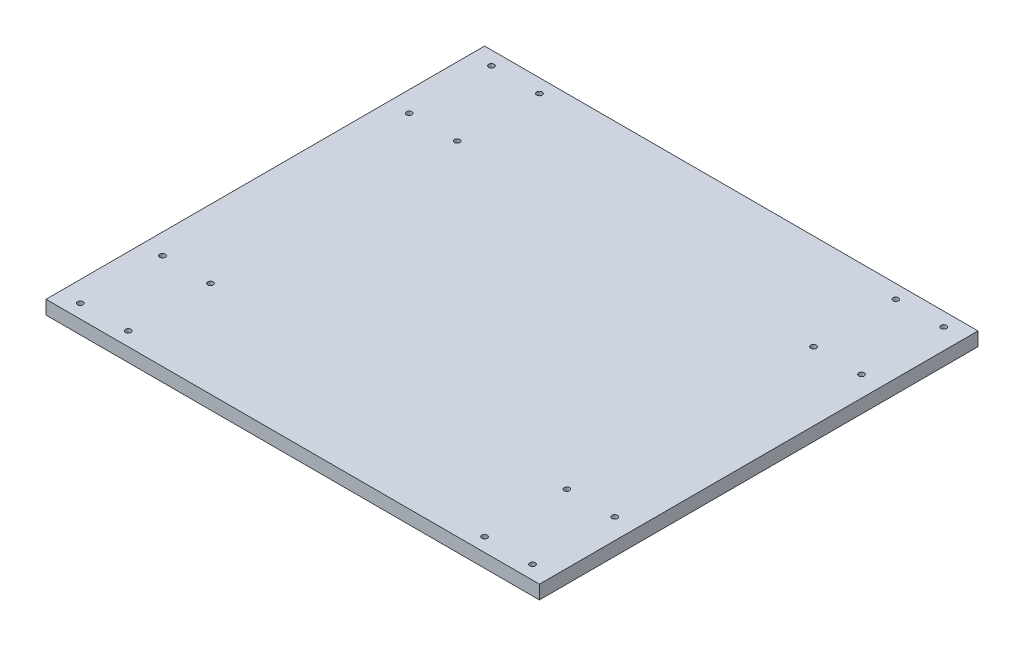
from build123d import *

# Parameters (mm, degrees)
SKETCH1_W                        = 457.2
SKETCH1_H                        = 406.4
BOSS_EXTRUDE1_DEPTH              = 12.7
F_1_4_20_TAPPED_HOLE1_AT_2_COUNT = 2
F_1_4_20_TAPPED_HOLE1_AT_2_PITCH = 76.2
F_1_4_20_TAPPED_HOLE1_AT_3_COUNT = 2
F_1_4_20_TAPPED_HOLE1_AT_3_PITCH = 88.217019333
F_1_4_20_TAPPED_HOLE1_AT_4_COUNT = 2
F_1_4_20_TAPPED_HOLE1_AT_4_PITCH = 44.45


with BuildPart() as part:
    # Sketch1 → Boss-Extrude1 (new body)
    with BuildSketch(Plane(origin=(0, 0, 0), x_dir=(1, 0, 0), z_dir=(0, 1, 0))):
        Rectangle(SKETCH1_W, SKETCH1_H)
    extrude(amount=BOSS_EXTRUDE1_DEPTH)

    # Sketch4 → 1/4-20 Tapped Hole1 (revolve, cut)
    with BuildSketch(Plane(origin=(-209.55, 12.7, 190.5), x_dir=(0, 0, 1), z_dir=(1, 0, 0))):
        Polygon((0, 0), (0, 18.043816902), (2.5527, 16.51), (2.5527, 0), align=None)
    f_1_4_20_tapped_hole1 = revolve(axis=Axis((-209.55, 19.05, 190.5), (0, -1, 0)), mode=Mode.SUBTRACT)

    # 1/4-20 Tapped Hole1 at 2: 1/4-20 Tapped Hole1 ×2
    with Locations(*[(0, 0, -i * F_1_4_20_TAPPED_HOLE1_AT_2_PITCH) for i in range(1, F_1_4_20_TAPPED_HOLE1_AT_2_COUNT)]):
        add(f_1_4_20_tapped_hole1, mode=Mode.SUBTRACT)

    # 1/4-20 Tapped Hole1 at 3: 1/4-20 Tapped Hole1 ×2
    with Locations(*[Vector(0.5038710255240861, 0, -0.8637789008984336) * (i * F_1_4_20_TAPPED_HOLE1_AT_3_PITCH) for i in range(1, F_1_4_20_TAPPED_HOLE1_AT_3_COUNT)]):
        add(f_1_4_20_tapped_hole1, mode=Mode.SUBTRACT)

    # 1/4-20 Tapped Hole1 at 4: 1/4-20 Tapped Hole1 ×2
    with Locations(*[(i * F_1_4_20_TAPPED_HOLE1_AT_4_PITCH, 0, 0) for i in range(1, F_1_4_20_TAPPED_HOLE1_AT_4_COUNT)]):
        add(f_1_4_20_tapped_hole1, mode=Mode.SUBTRACT)

    # Mirror1: 1/4-20 Tapped Hole1 across plane
    add(f_1_4_20_tapped_hole1.mirror(Plane(origin=(0, 0, 0), x_dir=(0, 0, 1), z_dir=(1, 0, 0))), mode=Mode.SUBTRACT)

    # Mirror1 copy 1 sketch → Mirror1 copy 1 (revolve, cut)
    with BuildSketch(Plane(origin=(209.55, 12.7, 114.3), x_dir=(0, 0, 1), z_dir=(-1, 0, 0))):
        Polygon((0, 0), (0, -18.043816902), (2.5527, -16.51), (2.5527, 0), align=None)
    revolve(axis=Axis((209.55, 19.05, 114.3), (0, 1, 0)), mode=Mode.SUBTRACT)

    # Mirror1 copy 2 sketch → Mirror1 copy 2 (revolve, cut)
    with BuildSketch(Plane(origin=(165.1, 12.7, 114.3), x_dir=(0, 0, 1), z_dir=(-1, 0, 0))):
        Polygon((0, 0), (0, -18.043816902), (2.5527, -16.51), (2.5527, 0), align=None)
    revolve(axis=Axis((165.1, 19.05, 114.3), (0, 1, 0)), mode=Mode.SUBTRACT)

    # Mirror1 copy 3 sketch → Mirror1 copy 3 (revolve, cut)
    with BuildSketch(Plane(origin=(165.1, 12.7, 190.5), x_dir=(0, 0, 1), z_dir=(-1, 0, 0))):
        Polygon((0, 0), (0, -18.043816902), (2.5527, -16.51), (2.5527, 0), align=None)
    revolve(axis=Axis((165.1, 19.05, 190.5), (0, 1, 0)), mode=Mode.SUBTRACT)

    # Mirror2: 1/4-20 Tapped Hole1 across plane
    add(f_1_4_20_tapped_hole1.mirror(Plane.XY), mode=Mode.SUBTRACT)

    # Mirror2 copy 1 sketch → Mirror2 copy 1 (revolve, cut)
    with BuildSketch(Plane(origin=(-209.55, 12.7, -114.3), x_dir=(0, 0, -1), z_dir=(1, 0, 0))):
        Polygon((0, 0), (0, -18.043816902), (2.5527, -16.51), (2.5527, 0), align=None)
    revolve(axis=Axis((-209.55, 19.05, -114.3), (0, 1, 0)), mode=Mode.SUBTRACT)

    # Mirror2 copy 2 sketch → Mirror2 copy 2 (revolve, cut)
    with BuildSketch(Plane(origin=(-165.1, 12.7, -114.3), x_dir=(0, 0, -1), z_dir=(1, 0, 0))):
        Polygon((0, 0), (0, -18.043816902), (2.5527, -16.51), (2.5527, 0), align=None)
    revolve(axis=Axis((-165.1, 19.05, -114.3), (0, 1, 0)), mode=Mode.SUBTRACT)

    # Mirror2 copy 3 sketch → Mirror2 copy 3 (revolve, cut)
    with BuildSketch(Plane(origin=(-165.1, 12.7, -190.5), x_dir=(0, 0, -1), z_dir=(1, 0, 0))):
        Polygon((0, 0), (0, -18.043816902), (2.5527, -16.51), (2.5527, 0), align=None)
    revolve(axis=Axis((-165.1, 19.05, -190.5), (0, 1, 0)), mode=Mode.SUBTRACT)

    # Mirror2 copy 4 sketch → Mirror2 copy 4 (revolve, cut)
    with BuildSketch(Plane(origin=(209.55, 12.7, -190.5), x_dir=(0, 0, -1), z_dir=(-1, 0, 0))):
        Polygon((0, 0), (0, 18.043816902), (2.5527, 16.51), (2.5527, 0), align=None)
    revolve(axis=Axis((209.55, 19.05, -190.5), (0, -1, 0)), mode=Mode.SUBTRACT)

    # Mirror2 copy 5 sketch → Mirror2 copy 5 (revolve, cut)
    with BuildSketch(Plane(origin=(209.55, 12.7, -114.3), x_dir=(0, 0, -1), z_dir=(-1, 0, 0))):
        Polygon((0, 0), (0, 18.043816902), (2.5527, 16.51), (2.5527, 0), align=None)
    revolve(axis=Axis((209.55, 19.05, -114.3), (0, -1, 0)), mode=Mode.SUBTRACT)

    # Mirror2 copy 6 sketch → Mirror2 copy 6 (revolve, cut)
    with BuildSketch(Plane(origin=(165.1, 12.7, -114.3), x_dir=(0, 0, -1), z_dir=(-1, 0, 0))):
        Polygon((0, 0), (0, 18.043816902), (2.5527, 16.51), (2.5527, 0), align=None)
    revolve(axis=Axis((165.1, 19.05, -114.3), (0, -1, 0)), mode=Mode.SUBTRACT)

    # Mirror2 copy 7 sketch → Mirror2 copy 7 (revolve, cut)
    with BuildSketch(Plane(origin=(165.1, 12.7, -190.5), x_dir=(0, 0, -1), z_dir=(-1, 0, 0))):
        Polygon((0, 0), (0, 18.043816902), (2.5527, 16.51), (2.5527, 0), align=None)
    revolve(axis=Axis((165.1, 19.05, -190.5), (0, -1, 0)), mode=Mode.SUBTRACT)


solid = part.part
